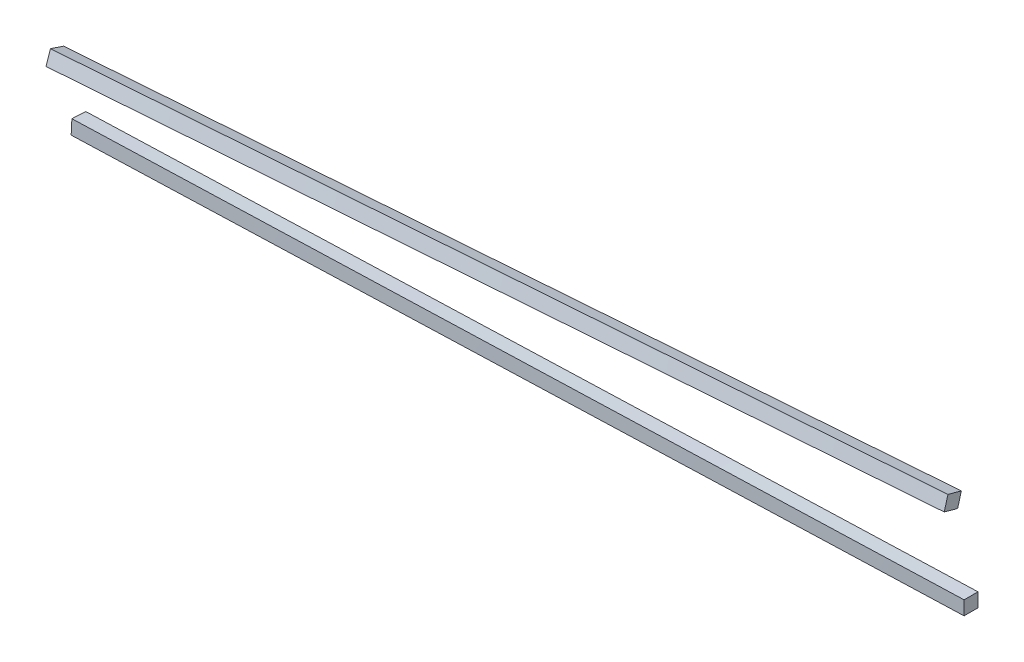
from build123d import *


with BuildPart() as part:
    # Sketch1<3> → Loft2 section 0
    with BuildSketch(Plane(origin=(0, 0, 0), x_dir=(0, 0, -1), z_dir=(1, 0, 0))):
        with BuildLine():
            Line((73.722592843, -17.689285792), (78.376128634, -18.967910303))
            Line((78.376128634, -18.967910303), (79.654753145, -14.314374511))
            Line((79.654753145, -14.314374511), (75.001217353, -13.035750001))
            Line((75.001217353, -13.035750001), (73.722592843, -17.689285792))
        make_face()
    # Sketch2<3> → Loft2 section 1
    with BuildSketch(Plane(origin=(-301.244, 0, 0), x_dir=(0, 0, -1), z_dir=(1, 0, 0))):
        with BuildLine():
            Line((67.679850957, -30.564309841), (63.101919005, -29.03695427))
            Line((63.101919005, -29.03695427), (64.629274577, -24.459022317))
            Line((64.629274577, -24.459022317), (69.207206529, -25.986377889))
            Line((69.207206529, -25.986377889), (67.679850957, -30.564309841))
        make_face()
    loft()


with BuildPart() as body_2:
    # Sketch1<6> → Loft5 section 0
    with BuildSketch(Plane(origin=(0, 0, 0), x_dir=(0, 0, -1), z_dir=(1, 0, 0))):
        with BuildLine():
            Line((80.606015408, -52.363936617), (85.432011787, -52.369848162))
            Line((85.432011787, -52.369848162), (85.437923333, -47.543851783))
            Line((85.437923333, -47.543851783), (80.611926953, -47.537940238))
            Line((80.611926953, -47.537940238), (80.606015408, -52.363936617))
        make_face()
    # Sketch2<8> → Loft5 section 1
    with BuildSketch(Plane(origin=(-301.244, 0, 0), x_dir=(0, 0, -1), z_dir=(1, 0, 0))):
        with BuildLine():
            Line((76.656597753, -54.31319682), (71.836959606, -54.065478974))
            Line((71.836959606, -54.065478974), (72.084677452, -49.245840827))
            Line((72.084677452, -49.245840827), (76.904315599, -49.493558673))
            Line((76.904315599, -49.493558673), (76.656597753, -54.31319682))
        make_face()
    loft()


solid = Compound([part.part, body_2.part])
